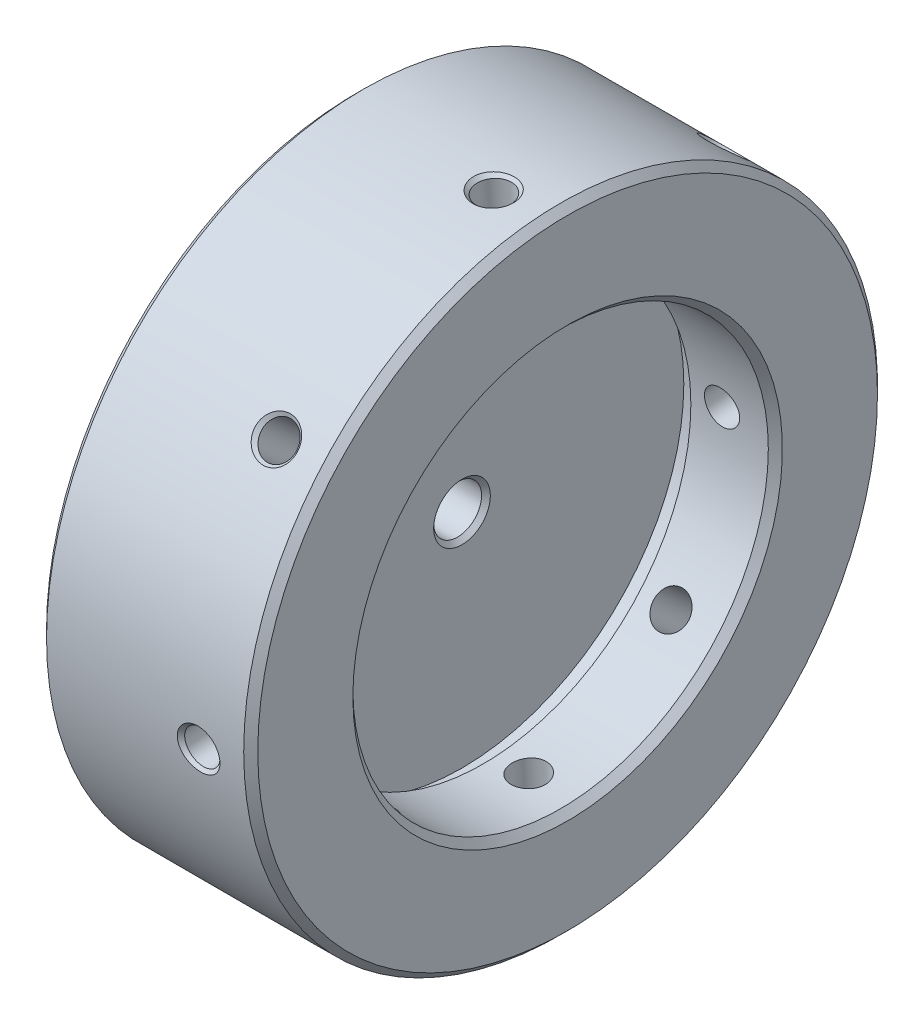
from build123d import *

# Parameters (mm, degrees)
CHAMFER_1_SIZE              = 1
HOLE_WIZARD_M81_D           = 6.8
HOLE_WIZARD_M81_CSINK_D     = 8.05
HOLE_WIZARD_M81_CSINK_ANGLE = 90
HOLE_WIZARD_M61_D           = 5
HOLE_WIZARD_M61_CSINK_D     = 6.05
HOLE_WIZARD_M61_CSINK_ANGLE = 90
PATTERN_CIRCULAR_1_COUNT    = 4
PATTERN_CIRCULAR_1_ANGLE    = 135


with BuildPart() as part:
    # Эскиз1 → Повернуть1 (revolve)
    with BuildSketch(Plane.XY, mode=Mode.PRIVATE) as revolve_1_sk:
        Polygon((0, 6.5), (11.258330249, 0), (30, 0), (30, 31.5), (33, 31.5), (33, 29.5), (45, 29.5), (45, 45), (15, 45), (15, 22.5), (0, 22.5), align=None)
    revolve(revolve_1_sk.sketch.rotate(Axis((0, 0, 0), (1, 0, 0)), 90), axis=Axis((0, 0, 0), (1, 0, 0)))

    # Фаска1
    chamfer_1_edges = [part.edges().sort_by_distance(p)[0] for p in [
        (45, 0, -45),
        (45, 0, -29.5),
        (0, 0, -22.5),
        (15, 0, -45),
    ]]
    chamfer(chamfer_1_edges, length=CHAMFER_1_SIZE)

    # Отверстие обработанное метчиком M81 (through all)
    with Locations(Plane(origin=(30, 0, 0), x_dir=(0, 0, -1), z_dir=(1, 0, 0))):
        with Locations((0, 0)):
            CounterSinkHole(HOLE_WIZARD_M81_D / 2, HOLE_WIZARD_M81_CSINK_D / 2, counter_sink_angle=HOLE_WIZARD_M81_CSINK_ANGLE)

    # Отверстие обработанное метчиком M61 (through all)
    with Locations(Plane(origin=(37.5, -3.003170306, 44.899676704), x_dir=(0, 0.99777059342, 0.066737117902), z_dir=(0, -0.066737117902, 0.99777059342))):
        with Locations((0, 0)):
            hole_wizard_m61 = CounterSinkHole(HOLE_WIZARD_M61_D / 2, HOLE_WIZARD_M61_CSINK_D / 2, counter_sink_angle=HOLE_WIZARD_M61_CSINK_ANGLE)

    # Круговой массив1: Отверстие обработанное метчиком M61 ×4 about axis
    pattern_circular_1_axis = Axis((0, 0, 0), (-1, 0, 0))
    for i in range(1, PATTERN_CIRCULAR_1_COUNT):
        add(hole_wizard_m61.rotate(pattern_circular_1_axis, i * PATTERN_CIRCULAR_1_ANGLE / (PATTERN_CIRCULAR_1_COUNT - 1)), mode=Mode.SUBTRACT)


solid = part.part
